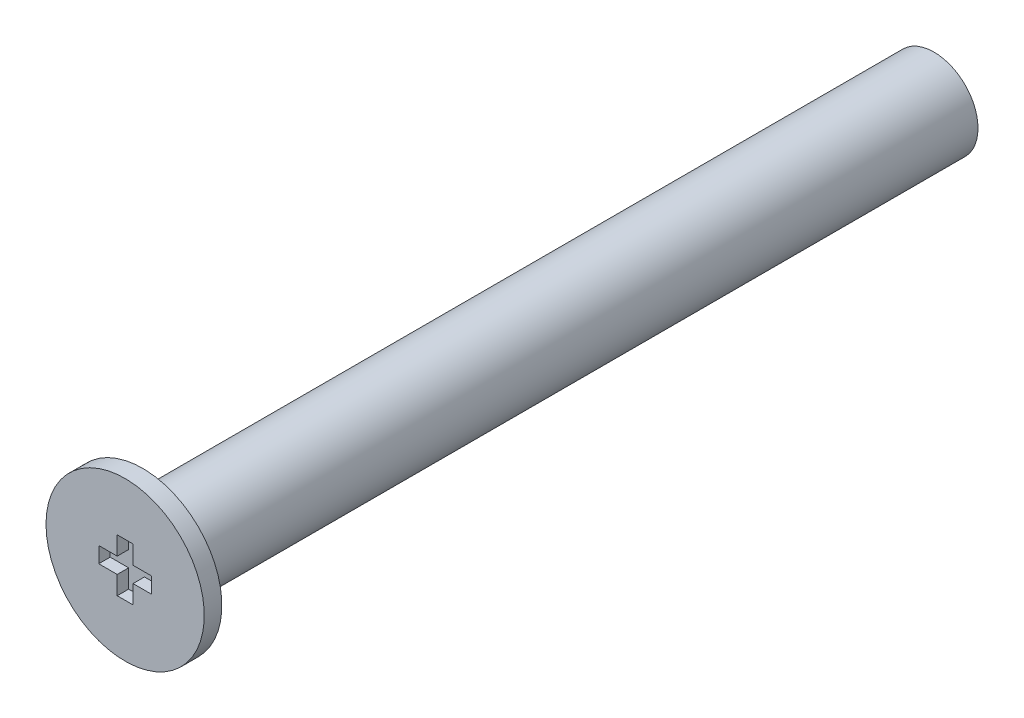
from build123d import *

# Parameters (mm, degrees)
SKETCH_1_R        = 2.5
EXTRUDE_198_DEPTH = 45
SKETCH_6_W        = 4.5
SKETCH_6_H        = 1
PH2_START         = 1.01
PH2_DEPTH         = 0.66


with BuildPart() as part:
    # 草图1 → Extrude 198 (new body)
    with BuildSketch(Plane.XY):
        Circle(SKETCH_1_R)
    extrude(amount=-EXTRUDE_198_DEPTH)

    # 草图6 → Revolve 324 (revolve)
    with BuildSketch(Plane(origin=(0, 0, 0), x_dir=(1, 0, 0), z_dir=(0, 1, 0)), mode=Mode.PRIVATE) as revolve_324_sk:
        with Locations((2.25, -0.5)):
            Rectangle(SKETCH_6_W, SKETCH_6_H)
    revolve(revolve_324_sk.sketch.rotate(Axis((0, 0, -2), (0, 0, 1)), 180), axis=Axis((0, 0, -2), (0, 0, 1)))

    # 草图7 → 十字槽_PH2_简化 (cut)
    with BuildSketch(Plane.XY.offset(PH2_START)):
        Polygon((-0.45, -1.5), (0.45, -1.5), (0.45, -0.45), (1.5, -0.45), (1.5, 0.45), (0.45, 0.45), (0.45, 1.5), (-0.45, 1.5), (-0.45, 0.45), (-1.5, 0.45), (-1.5, -0.45), (-0.45, -0.45), align=None)
    extrude(amount=-PH2_DEPTH, mode=Mode.SUBTRACT)


solid = part.part
